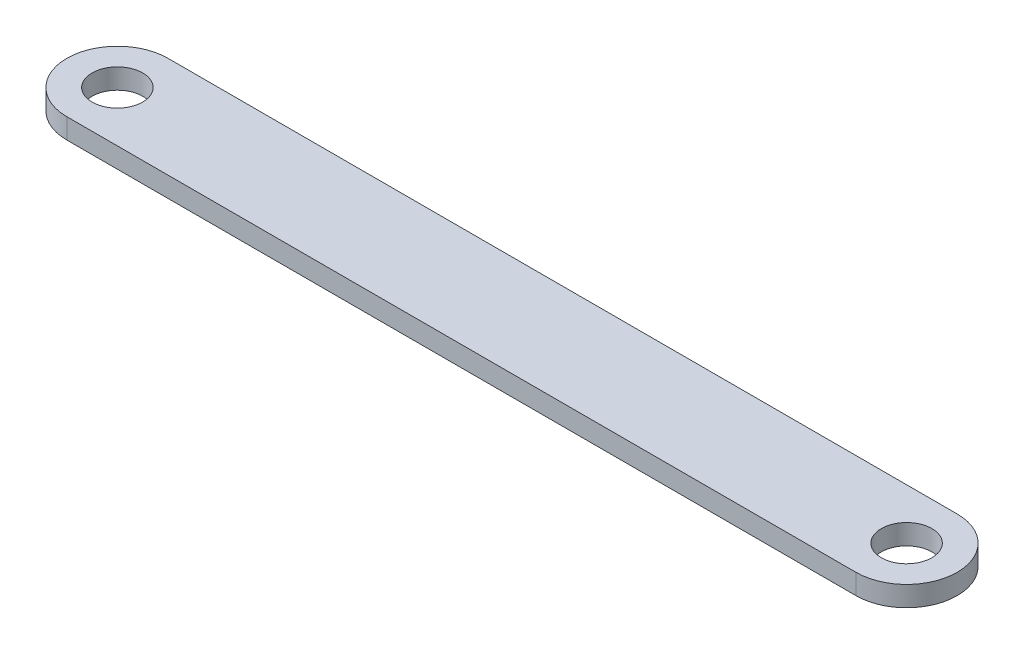
from build123d import *

# Parameters (mm, degrees)
SKETCH2_R           = 6.35
BOSS_EXTRUDE1_DEPTH = 5.08


with BuildPart() as part:
    # Sketch2 → Boss-Extrude1 (new body)
    with BuildSketch(Plane(origin=(0, 0, 0), x_dir=(1, 0, 0), z_dir=(0, 1, 0))):
        with BuildLine():
            Line((-198.2, 12.7), (0, 12.7))
            ThreePointArc((0, 12.7), (12.7, 0), (0, -12.7))
            Line((0, -12.7), (-198.2, -12.7))
            ThreePointArc((-198.2, -12.7), (-210.9, 0), (-198.2, 12.7))
        make_face()
        with Locations(Location((0, 0, 0), (0, 0, 270))):
            Circle(SKETCH2_R, mode=Mode.SUBTRACT)
        with Locations(Location((-198.2, 0, 0), (0, 0, 270))):
            Circle(SKETCH2_R, mode=Mode.SUBTRACT)
    extrude(amount=BOSS_EXTRUDE1_DEPTH)


solid = part.part
